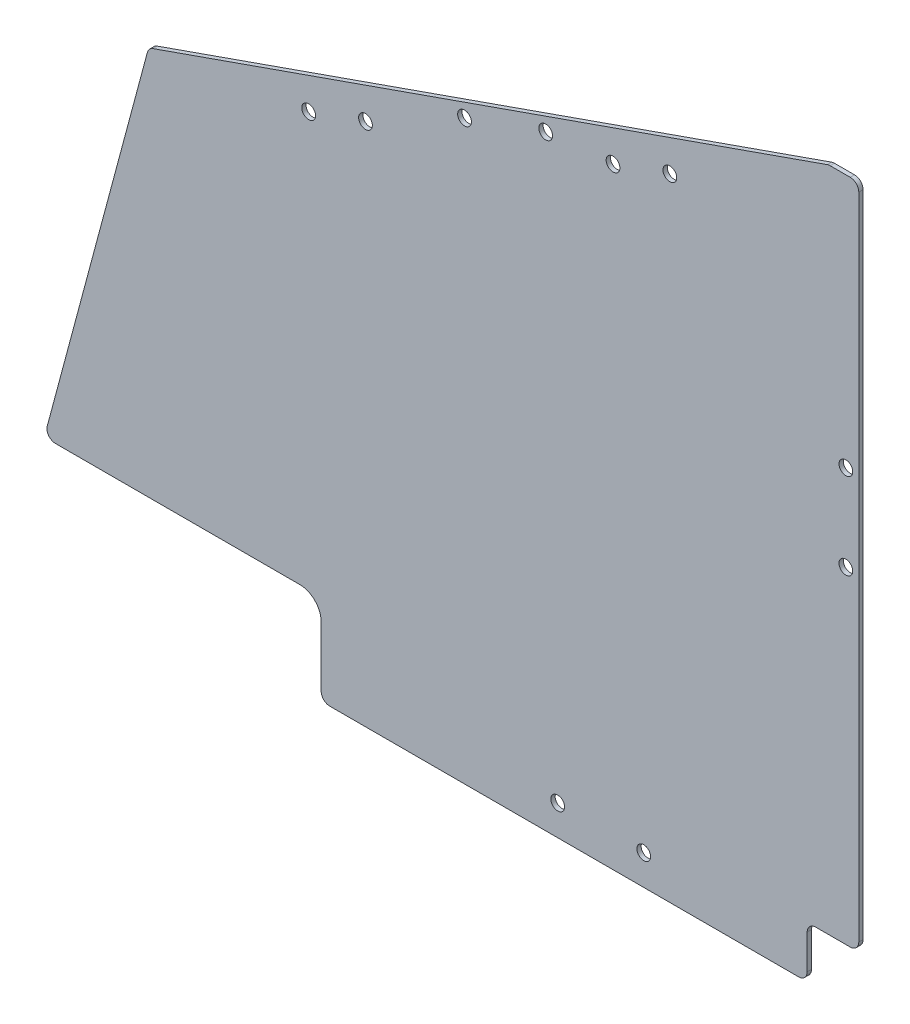
from build123d import *

# Parameters (mm, degrees)
SKETCH_1_W          = 190
SKETCH_1_H          = 167
EXTRUDE_1_DEPTH     = 1
CUT_EXTRUDE_1_DEPTH = 1
SKETCH_3_W          = 65
SKETCH_3_H          = 21
CUT_EXTRUDE_2_DEPTH = 1
SKETCH_4_R          = 1.6
CUT_EXTRUDE_3_DEPTH = 1
SKETCH_9_R          = 1.6
CUT_EXTRUDE_5_DEPTH = 10
FILLET_1_R          = 5
FILLET_2_R          = 2
SKETCH_10_R         = 1.6
CUT_EXTRUDE_6_DEPTH = 10
SKETCH_11_W         = 12
SKETCH_11_H         = 12
CUT_EXTRUDE_7_DEPTH = 10
FILLET_3_R          = 2
SKETCH_12_R         = 1.6
CUT_EXTRUDE_8_DEPTH = 10


with BuildPart() as part:
    # 草图1 → 凸台-拉伸1 (new body)
    with BuildSketch(Plane.XY):
        Rectangle(SKETCH_1_W, SKETCH_1_H)
    extrude(amount=EXTRUDE_1_DEPTH)

    # 草图2 → 切除-拉伸1 (cut)
    with BuildSketch(Plane(origin=(0, 0, 0), x_dir=(-1, 0, 0), z_dir=(0, 0, -1))):
        Polygon((100, -83.5), (119, -83.5), (119, 83.5), (55.252484864, 83.5), align=None)
    extrude(amount=-CUT_EXTRUDE_1_DEPTH, mode=Mode.SUBTRACT)

    # 草图3 → 切除-拉伸2 (cut)
    with BuildSketch(Plane(origin=(0, 0, 0), x_dir=(-1, 0, 0), z_dir=(0, 0, -1))):
        with Locations((62.5, -73)):
            Rectangle(SKETCH_3_W, SKETCH_3_H)
        Polygon((-88, 83.5), (55.252484864, 83.5), (70.123665044, 28), align=None)
    extrude(amount=-CUT_EXTRUDE_2_DEPTH, mode=Mode.SUBTRACT)

    # 草图4 → 切除-拉伸3 (cut)
    with BuildSketch(Plane(origin=(0, 0, 0), x_dir=(-1, 0, 0), z_dir=(0, 0, -1))):
        with Locations((-92, 4.5)):
            Circle(SKETCH_4_R)
        with Locations((-92, 24.5)):
            Circle(SKETCH_4_R)
    extrude(amount=-CUT_EXTRUDE_3_DEPTH, mode=Mode.SUBTRACT)

    # 草图9 → 切除-拉伸5 (cut)
    with BuildSketch(Plane(origin=(0, 0, 0), x_dir=(-1, 0, 0), z_dir=(0, 0, -1))):
        with Locations((-22.205756698, 57.227379318)):
            Circle(SKETCH_9_R)
        with Locations((-3.334428743, 50.603711057)):
            Circle(SKETCH_9_R)
    extrude(amount=-CUT_EXTRUDE_5_DEPTH, mode=Mode.SUBTRACT)

    # 圆角1
    fillet_1_edges = [part.edges().sort_by_distance(p)[0] for p in [
        (-30, -62.5, 0.5),
    ]]
    fillet(fillet_1_edges, radius=FILLET_1_R)

    # 圆角2
    fillet_2_edges = [part.edges().sort_by_distance(p)[0] for p in [
        (-94.373066959, -62.5, 0.5),
        (-70.123665044, 28, 0.5),
        (88, 83.5, 0.5),
        (-30, -83.5, 0.5),
        (95, -83.5, 0.5),
        (95, 83.5, 0.5),
    ]]
    fillet(fillet_2_edges, radius=FILLET_2_R)

    # 草图10 → 切除-拉伸6 (cut)
    with BuildSketch(Plane.XY.offset(1)):
        with Locations((45, -76.5)):
            Circle(SKETCH_10_R)
        with Locations((25, -76.5)):
            Circle(SKETCH_10_R)
    extrude(amount=-CUT_EXTRUDE_6_DEPTH, mode=Mode.SUBTRACT)

    # 草图11 → 切除-拉伸7 (cut)
    with BuildSketch(Plane(origin=(0, 0, 0), x_dir=(-1, 0, 0), z_dir=(0, 0, -1))):
        with Locations((-89, -77.5)):
            Rectangle(SKETCH_11_W, SKETCH_11_H)
    extrude(amount=-CUT_EXTRUDE_7_DEPTH, mode=Mode.SUBTRACT)

    # 圆角3
    fillet_3_edges = [part.edges().sort_by_distance(p)[0] for p in [
        (95, -71.5, 0.5),
        (83, -71.5, 0.5),
        (83, -83.5, 0.5),
    ]]
    fillet(fillet_3_edges, radius=FILLET_3_R)

    # 草图12 → 切除-拉伸8 (cut)
    with BuildSketch(Plane.XY.offset(1)):
        with Locations((-32.906682955, 33.75014876)):
            Circle(SKETCH_12_R)
        with Locations((-19.696753387, 38.386716542)):
            Circle(SKETCH_12_R)
        with Locations((37.860796874, 58.588904739)):
            Circle(SKETCH_12_R)
        with Locations((51.070726442, 63.225472522)):
            Circle(SKETCH_12_R)
    extrude(amount=-CUT_EXTRUDE_8_DEPTH, mode=Mode.SUBTRACT)


solid = part.part
